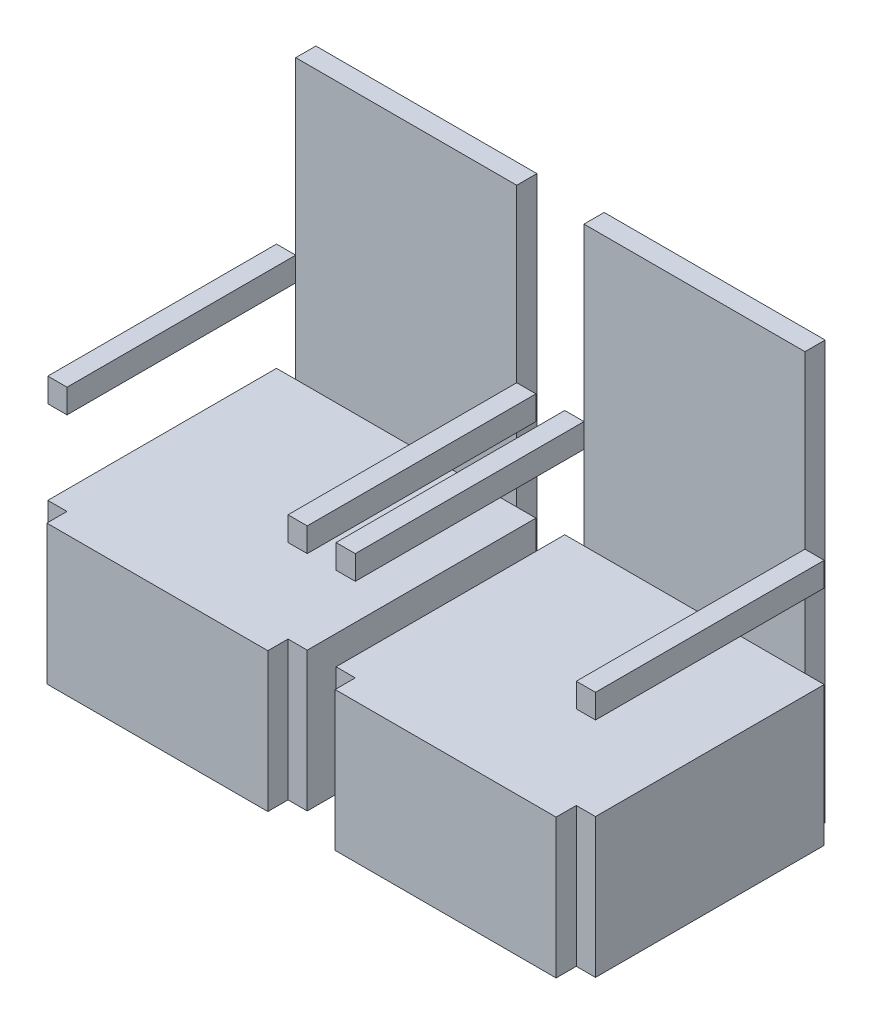
from build123d import *

# Parameters (mm, degrees)
BOSS_EXTRUDE1_DEPTH   = 368.3
BOSS_EXTRUDE1_2_DEPTH = 368.3
SKETCH2_W             = 584.2
SKETCH2_H             = 53.34
BOSS_EXTRUDE2_DEPTH   = 736.6
SKETCH3_W             = 50.8
SKETCH3_H             = 63.5
BOSS_EXTRUDE3_DEPTH   = 604.52
BOSS_EXTRUDE3_2_DEPTH = 604.52
BOSS_EXTRUDE3_3_DEPTH = 604.52
BOSS_EXTRUDE3_4_DEPTH = 604.52


with BuildPart() as part:
    # Sketch1 → Boss-Extrude1 (new body)
    with BuildSketch(Plane(origin=(0, 0, 0), x_dir=(1, 0, 0), z_dir=(0, 1, 0))):
        Polygon((-723.9, 302.26), (-673.1, 302.26), (-673.1, 355.6), (-88.9, 355.6), (-88.9, 302.26), (-38.1, 302.26), (-38.1, -302.26), (-88.9, -302.26), (-88.9, -355.6), (-673.1, -355.6), (-673.1, -302.26), (-723.9, -302.26), align=None)
    extrude(amount=BOSS_EXTRUDE1_DEPTH)



with BuildPart() as body_2:
    # Sketch1 → Boss-Extrude1 2 (new body)
    with BuildSketch(Plane(origin=(0, 0, 0), x_dir=(1, 0, 0), z_dir=(0, 1, 0))):
        Polygon((88.9, -355.6), (673.1, -355.6), (673.1, -302.26), (723.9, -302.26), (723.9, 302.26), (673.1, 302.26), (673.1, 355.6), (88.9, 355.6), (88.9, 302.26), (38.1, 302.26), (38.1, -302.26), (88.9, -302.26), align=None)
    extrude(amount=BOSS_EXTRUDE1_2_DEPTH)


with BuildPart() as part_1:
    add(part.part)

    add(body_2.part)  # Boss-Extrude2 merges body 2
    # Sketch2 → Boss-Extrude2 (add)
    with BuildSketch(Plane(origin=(0, 368.3, 0), x_dir=(1, 0, 0), z_dir=(0, 1, 0))):
        with Locations((-381, 328.93)):
            Rectangle(SKETCH2_W, SKETCH2_H)
        with Locations((381, 328.93)):
            Rectangle(SKETCH2_W, SKETCH2_H)
    extrude(amount=BOSS_EXTRUDE2_DEPTH)


with BuildPart() as body_2_2:
    # Sketch3 → Boss-Extrude3 (new body)
    with BuildSketch(Plane.XY.offset(-302.26)):
        with Locations((-698.5, 621.03)):
            Rectangle(SKETCH3_W, SKETCH3_H)
    extrude(amount=BOSS_EXTRUDE3_DEPTH)


with BuildPart() as body_3:
    # Sketch3 → Boss-Extrude3 2 (new body)
    with BuildSketch(Plane.XY.offset(-302.26)):
        with Locations((698.5, 621.03)):
            Rectangle(SKETCH3_W, SKETCH3_H)
    extrude(amount=BOSS_EXTRUDE3_2_DEPTH)


with BuildPart() as body_4:
    # Sketch3 → Boss-Extrude3 3 (new body)
    with BuildSketch(Plane.XY.offset(-302.26)):
        with Locations((-63.5, 621.03)):
            Rectangle(SKETCH3_W, SKETCH3_H)
    extrude(amount=BOSS_EXTRUDE3_3_DEPTH)


with BuildPart() as body_5:
    # Sketch3 → Boss-Extrude3 4 (new body)
    with BuildSketch(Plane.XY.offset(-302.26)):
        with Locations((63.5, 621.03)):
            Rectangle(SKETCH3_W, SKETCH3_H)
    extrude(amount=BOSS_EXTRUDE3_4_DEPTH)


solid = Compound([part_1.part, body_2_2.part, body_3.part, body_4.part, body_5.part])
